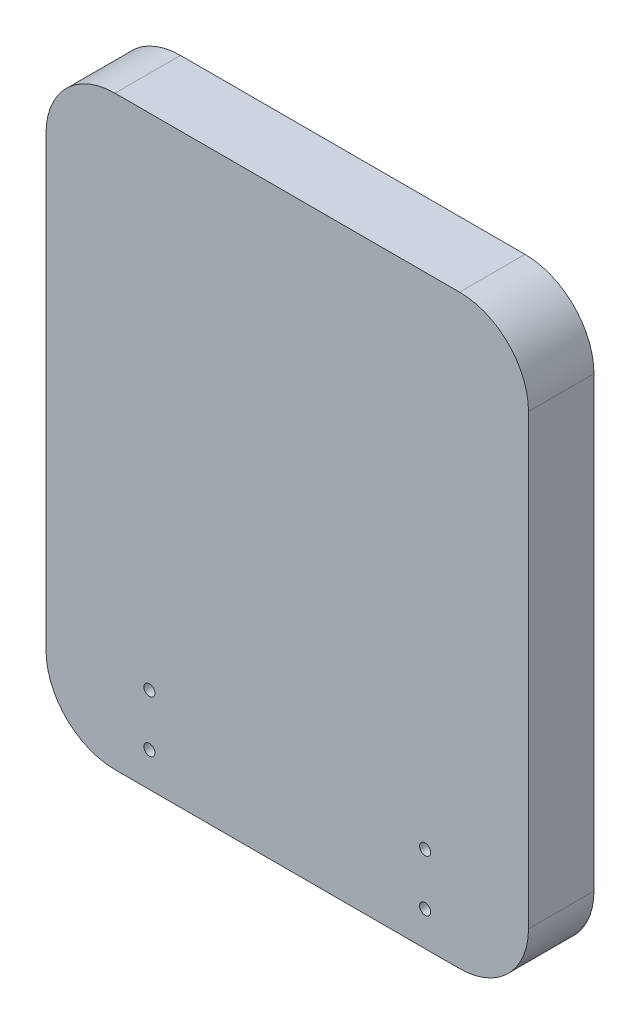
from build123d import *

# Parameters (mm, degrees)
BOSS_EXTRUDE1_DEPTH                      = 5
BOSS_EXTRUDE1_DEPTH_BACK                 = 14
SKETCH1_W                                = 140
SKETCH1_H                                = 170
FILLET1_R                                = 20
SHELL2_T                                 = -4
SHELL2_THICKNESS_2_DEPTH                 = 1
SKETCH2_R                                = 1.8
CUT_EXTRUDE1_DEPTH                       = 4.5
SKETCH3_R                                = 1.8
CUT_EXTRUDE3_DEPTH                       = 4.5
CUT_EXTRUDE4_DEPTH                       = 4
BOSS_EXTRUDE2_DEPTH                      = 14
CUT_EXTRUDE5_DEPTH                       = 4.5
MIRROR1_AT_THE_SECOND_PLANE_COPY_1_DEPTH = 14
MIRROR1_AT_THE_SECOND_PLANE_COPY_2_DEPTH = 4.5
FILLET2_R                                = 3
CHAMFER1_SIZE                            = 0.5
SKETCH7_R                                = 1.6
CUT_EXTRUDE6_DEPTH                       = 126.363678033
SKETCH7_3_R                              = 1.6
CUT_EXTRUDE7_DEPTH                       = 2.5


with BuildPart() as part:
    # Sketch1 → Boss-Extrude1 (new, two sides: drawn at the far end of the back side and taken through both)
    with BuildSketch(Plane.XY.offset(-BOSS_EXTRUDE1_DEPTH_BACK)):
        with Locations((-2.877308189, 16.03934739)):
            Rectangle(SKETCH1_W, SKETCH1_H)
    extrude(amount=BOSS_EXTRUDE1_DEPTH + BOSS_EXTRUDE1_DEPTH_BACK)

    # Fillet1
    fillet1_edges = [part.edges().sort_by_distance(p)[0] for p in [
        (67.122691811, -68.96065261, -4.5),
        (-72.877308189, -68.96065261, -4.5),
        (-72.877308189, 101.03934739, -4.5),
        (67.122691811, 101.03934739, -4.5),
    ]]
    fillet(fillet1_edges, radius=FILLET1_R)

    # Shell2
    shell2_openings = [part.faces().sort_by_distance(p)[0] for p in [
        (-2.877308189, 16.03934739, -14),
    ]]
    offset(amount=SHELL2_T, openings=shell2_openings, kind=Kind.INTERSECTION)

    # Shell2 thickness 2 face (on inner face of the shell) → Shell2 thickness 2 (add)
    with BuildSketch(Plane(origin=(-2.877308189, 16.03934739, 1), x_dir=(1, 0, 0), z_dir=(0, 0, 1))):
        with BuildLine():
            ThreePointArc((-66, 65), (-61.313708499, 76.313708499), (-50, 81))
            Line((-50, 81), (50, 81))
            ThreePointArc((50, 81), (61.313708499, 76.313708499), (66, 65))
            Line((66, 65), (66, -65))
            ThreePointArc((66, -65), (61.313708499, -76.313708499), (50, -81))
            Line((50, -81), (-50, -81))
            ThreePointArc((-50, -81), (-61.313708499, -76.313708499), (-66, -65))
            Line((-66, -65), (-66, 65))
        make_face()
    extrude(amount=-SHELL2_THICKNESS_2_DEPTH)

    # Sketch2 → Cut-Extrude1 (cut)
    with BuildSketch(Plane(origin=(0, 0, 0), x_dir=(-1, 0, 0), z_dir=(0, 0, -1))):
        with Locations((10.377308189, -40.96065261)):
            Circle(SKETCH2_R)
        with Locations((10.377308189, -17.96065261)):
            Circle(SKETCH2_R)
        with Locations((-47.622691811, -17.96065261)):
            Circle(SKETCH2_R)
        with Locations((-47.622691811, -40.96065261)):
            Circle(SKETCH2_R)
    extrude(amount=-CUT_EXTRUDE1_DEPTH, mode=Mode.SUBTRACT)

    # Sketch3 → Cut-Extrude3 (cut)
    with BuildSketch(Plane(origin=(0, 0, 0), x_dir=(-1, 0, 0), z_dir=(0, 0, -1))):
        with Locations((-58.622691811, -5.56065261)):
            Circle(SKETCH3_R)
        with Locations((21.377308189, -5.56065261)):
            Circle(SKETCH3_R)
    extrude(amount=-CUT_EXTRUDE3_DEPTH, mode=Mode.SUBTRACT)

    # Sketch4 → Cut-Extrude4 (cut)
    with BuildSketch(Plane.XZ.offset(68.96065261)):
        with BuildLine():
            ThreePointArc((-6.127308189, -5.08), (-2.877308189, -8.33), (0.372691811, -5.08))
            Line((0.372691811, -5.08), (-6.127308189, -5.08))
        make_face()
        with BuildLine():
            Line((-6.127308189, -5.08), (0.372691811, -5.08))
            ThreePointArc((0.372691811, -5.08), (-2.877308189, -1.83), (-6.127308189, -5.08))
        make_face()
        with BuildLine():
            Line((0.372691811, -14), (0.372691811, -5.08))
            ThreePointArc((0.372691811, -5.08), (-2.877308189, -8.33), (-6.127308189, -5.08))
            Line((-6.127308189, -5.08), (-6.127308189, -14))
            Line((-6.127308189, -14), (0.372691811, -14))
        make_face()
    extrude(amount=-CUT_EXTRUDE4_DEPTH, mode=Mode.SUBTRACT)

    # Sketch6 → Boss-Extrude2 (add)
    with BuildSketch(Plane(origin=(0, 0, -14), x_dir=(-1, 0, 0), z_dir=(0, 0, -1))):
        with BuildLine():
            ThreePointArc((-53.531671708, 85.013896159), (-58.995830787, 86.670706643), (-58.43640031, 92.353055889))
            ThreePointArc((-58.43640031, 92.353055889), (-61.904764331, 87.162282308), (-63.122691811, 81.03934739))
            Line((-63.122691811, 81.03934739), (-53.531671708, 85.013896159))
        make_face()
        with BuildLine():
            ThreePointArc((-50.754419795, 89.171075374), (-53.532344349, 93.32853327), (-58.43640031, 92.353055889))
            Line((-58.43640031, 92.353055889), (-56.810054714, 90.726710293))
            ThreePointArc((-56.810054714, 90.726710293), (-54.412516244, 91.203610346), (-53.054419795, 89.171075374))
            ThreePointArc((-53.054419795, 89.171075374), (-53.221884823, 88.329171823), (-53.698784876, 87.615440455))
            Line((-53.698784876, 87.615440455), (-52.07243928, 85.989094859))
            ThreePointArc((-52.07243928, 85.989094859), (-51.513008803, 86.670706643), (-51.097240579, 87.448327288))
            ThreePointArc((-51.097240579, 87.448327288), (-50.840957069, 88.29281188), (-50.754419795, 89.171075374))
        make_face()
        with BuildLine():
            Line((-56.810054714, 90.726710293), (-58.43640031, 92.353055889))
            ThreePointArc((-58.43640031, 92.353055889), (-58.995830787, 86.670706643), (-53.531671708, 85.013896159))
            ThreePointArc((-53.531671708, 85.013896159), (-52.754051064, 85.429664382), (-52.07243928, 85.989094859))
            Line((-52.07243928, 85.989094859), (-53.698784876, 87.615440455))
            ThreePointArc((-53.698784876, 87.615440455), (-56.810054714, 87.615440455), (-56.810054714, 90.726710293))
        make_face()
        with BuildLine():
            ThreePointArc((-47.122691811, 97.03934739), (-53.245626729, 95.821419911), (-58.43640031, 92.353055889))
            ThreePointArc((-58.43640031, 92.353055889), (-53.532344349, 93.32853327), (-50.754419795, 89.171075374))
            ThreePointArc((-50.754419795, 89.171075374), (-50.840957069, 88.29281188), (-51.097240579, 87.448327288))
            Line((-51.097240579, 87.448327288), (-47.122691811, 97.03934739))
        make_face()
        with BuildLine():
            ThreePointArc((-53.054419795, 89.171075374), (-54.412516244, 91.203610346), (-56.810054714, 90.726710293))
            Line((-56.810054714, 90.726710293), (-53.698784876, 87.615440455))
            ThreePointArc((-53.698784876, 87.615440455), (-53.221884823, 88.329171823), (-53.054419795, 89.171075374))
        make_face()
        with BuildLine():
            Line((-53.698784876, 87.615440455), (-56.810054714, 90.726710293))
            ThreePointArc((-56.810054714, 90.726710293), (-56.810054714, 87.615440455), (-53.698784876, 87.615440455))
        make_face()
    boss_extrude2 = extrude(amount=-BOSS_EXTRUDE2_DEPTH)

    # Sketch6<3> → Cut-Extrude5 (cut)
    with BuildSketch(Plane(origin=(0, 0, -14), x_dir=(-1, 0, 0), z_dir=(0, 0, -1))):
        with BuildLine():
            ThreePointArc((-53.054419795, 89.171075374), (-54.412516244, 91.203610346), (-56.810054714, 90.726710293))
            Line((-56.810054714, 90.726710293), (-53.698784876, 87.615440455))
            ThreePointArc((-53.698784876, 87.615440455), (-53.221884823, 88.329171823), (-53.054419795, 89.171075374))
        make_face()
        with BuildLine():
            Line((-53.698784876, 87.615440455), (-56.810054714, 90.726710293))
            ThreePointArc((-56.810054714, 90.726710293), (-56.810054714, 87.615440455), (-53.698784876, 87.615440455))
        make_face()
    cut_extrude5 = extrude(amount=-CUT_EXTRUDE5_DEPTH, mode=Mode.SUBTRACT)

    # Mirror1: Boss-Extrude2, Cut-Extrude5 across plane
    add(boss_extrude2.mirror(Plane(origin=(0, 16.03934739, 0), x_dir=(0, 0, 1), z_dir=(0, -1, 0))))
    add(cut_extrude5.mirror(Plane(origin=(0, 16.03934739, 0), x_dir=(0, 0, 1), z_dir=(0, -1, 0))), mode=Mode.SUBTRACT)

    # Mirror1 at the second plane: Boss-Extrude2, Cut-Extrude5 across plane
    add(boss_extrude2.mirror(Plane(origin=(-2.877308189, 0, 0), x_dir=(0, 0, 1), z_dir=(1, 0, 0))))
    add(cut_extrude5.mirror(Plane(origin=(-2.877308189, 0, 0), x_dir=(0, 0, 1), z_dir=(1, 0, 0))), mode=Mode.SUBTRACT)

    # Mirror1 at the second plane copy 1 sketc → Mirror1 at the second plane copy 1 (add)
    with BuildSketch(Plane(origin=(-5.754616377, 32.078694781, -14), x_dir=(1, 0, 0), z_dir=(0, 0, -1))):
        with BuildLine():
            ThreePointArc((-53.531671708, 85.013896159), (-58.995830787, 86.670706643), (-58.43640031, 92.353055889))
            ThreePointArc((-58.43640031, 92.353055889), (-61.904764331, 87.162282308), (-63.122691811, 81.03934739))
            Line((-63.122691811, 81.03934739), (-53.531671708, 85.013896159))
        make_face()
        with BuildLine():
            ThreePointArc((-50.754419795, 89.171075374), (-53.532344349, 93.32853327), (-58.43640031, 92.353055889))
            Line((-58.43640031, 92.353055889), (-56.810054714, 90.726710293))
            ThreePointArc((-56.810054714, 90.726710293), (-54.412516244, 91.203610346), (-53.054419795, 89.171075374))
            ThreePointArc((-53.054419795, 89.171075374), (-53.221884823, 88.329171823), (-53.698784876, 87.615440455))
            Line((-53.698784876, 87.615440455), (-52.07243928, 85.989094859))
            ThreePointArc((-52.07243928, 85.989094859), (-51.513008803, 86.670706643), (-51.097240579, 87.448327288))
            ThreePointArc((-51.097240579, 87.448327288), (-50.840957069, 88.29281188), (-50.754419795, 89.171075374))
        make_face()
        with BuildLine():
            Line((-56.810054714, 90.726710293), (-58.43640031, 92.353055889))
            ThreePointArc((-58.43640031, 92.353055889), (-58.995830787, 86.670706643), (-53.531671708, 85.013896159))
            ThreePointArc((-53.531671708, 85.013896159), (-52.754051064, 85.429664382), (-52.07243928, 85.989094859))
            Line((-52.07243928, 85.989094859), (-53.698784876, 87.615440455))
            ThreePointArc((-53.698784876, 87.615440455), (-56.810054714, 87.615440455), (-56.810054714, 90.726710293))
        make_face()
        with BuildLine():
            ThreePointArc((-47.122691811, 97.03934739), (-53.245626729, 95.821419911), (-58.43640031, 92.353055889))
            ThreePointArc((-58.43640031, 92.353055889), (-53.532344349, 93.32853327), (-50.754419795, 89.171075374))
            ThreePointArc((-50.754419795, 89.171075374), (-50.840957069, 88.29281188), (-51.097240579, 87.448327288))
            Line((-51.097240579, 87.448327288), (-47.122691811, 97.03934739))
        make_face()
        with BuildLine():
            ThreePointArc((-53.054419795, 89.171075374), (-54.412516244, 91.203610346), (-56.810054714, 90.726710293))
            Line((-56.810054714, 90.726710293), (-53.698784876, 87.615440455))
            ThreePointArc((-53.698784876, 87.615440455), (-53.221884823, 88.329171823), (-53.054419795, 89.171075374))
        make_face()
        with BuildLine():
            Line((-53.698784876, 87.615440455), (-56.810054714, 90.726710293))
            ThreePointArc((-56.810054714, 90.726710293), (-56.810054714, 87.615440455), (-53.698784876, 87.615440455))
        make_face()
    extrude(amount=-MIRROR1_AT_THE_SECOND_PLANE_COPY_1_DEPTH)

    # Mirror1 at the second plane copy 2 sketc → Mirror1 at the second plane copy 2 (cut)
    with BuildSketch(Plane(origin=(-5.754616377, 32.078694781, -14), x_dir=(1, 0, 0), z_dir=(0, 0, -1))):
        with BuildLine():
            ThreePointArc((-53.054419795, 89.171075374), (-54.412516244, 91.203610346), (-56.810054714, 90.726710293))
            Line((-56.810054714, 90.726710293), (-53.698784876, 87.615440455))
            ThreePointArc((-53.698784876, 87.615440455), (-53.221884823, 88.329171823), (-53.054419795, 89.171075374))
        make_face()
        with BuildLine():
            Line((-53.698784876, 87.615440455), (-56.810054714, 90.726710293))
            ThreePointArc((-56.810054714, 90.726710293), (-56.810054714, 87.615440455), (-53.698784876, 87.615440455))
        make_face()
    extrude(amount=-MIRROR1_AT_THE_SECOND_PLANE_COPY_2_DEPTH, mode=Mode.SUBTRACT)

    # Fillet2
    fillet2_edges = [part.edges().sort_by_distance(p)[0] for p in [
        (63.122691811, 81.03934739, -7),
        (63.122691811, -48.96065261, -7),
        (-68.877308189, 81.03934739, -7),
        (-68.877308189, -48.96065261, -7),
        (-52.877308189, 97.03934739, -7),
        (47.122691811, 97.03934739, -7),
    ]]
    fillet(fillet2_edges, radius=FILLET2_R)

    # Chamfer1
    chamfer1_edges = [part.edges().sort_by_distance(p)[0] for p in [
        (53.698784876, 87.615440455, -14),
        (-59.453401254, 87.615440455, -14),
        (53.698784876, -55.536745675, -14),
        (-59.453401254, -55.536745675, -14),
        (49.422691811, -40.96065261, 0),
        (49.422691811, -17.96065261, 0),
        (-8.577308189, -17.96065261, 0),
        (-8.577308189, -40.96065261, 0),
        (60.422691811, -5.56065261, 0),
        (-19.577308189, -5.56065261, 0),
    ]]
    chamfer(chamfer1_edges, length=CHAMFER1_SIZE)

    # Sketch7 → Cut-Extrude6 (cut, through all)
    with BuildSketch(Plane(origin=(0, 0, 0), x_dir=(-1, 0, 0), z_dir=(0, 0, -1))):
        with Locations((-37.122691811, -58.96065261)):
            Circle(SKETCH7_R)
        with Locations((-37.122691811, -43.96065261)):
            Circle(SKETCH7_R)
    cut_extrude6 = extrude(amount=-CUT_EXTRUDE6_DEPTH, mode=Mode.SUBTRACT)

    # Sketch7<3> → Cut-Extrude7 (cut)
    # profile 1 of 2: a face of its own
    with BuildSketch(Plane(origin=(0, 0, 0), x_dir=(-1, 0, 0), z_dir=(0, 0, -1))):
        Polygon((-37.122691811, -47.424754225), (-34.122691811, -45.692703417), (-34.122691811, -42.228601802), (-37.122691811, -40.496550994), (-40.122691811, -42.228601802), (-40.122691811, -45.692703417), align=None)
        with Locations((-37.122691811, -43.96065261)):
            Circle(SKETCH7_3_R, mode=Mode.SUBTRACT)
    # profile 2 of 2: a face of its own
    with BuildSketch(Plane(origin=(0, 0, 0), x_dir=(-1, 0, 0), z_dir=(0, 0, -1))):
        Polygon((-37.117210505, -55.496555331), (-40.119947403, -57.22385702), (-40.125428709, -60.687954299), (-37.128173117, -62.424749888), (-34.12543622, -60.697448199), (-34.119954914, -57.233350921), align=None)
        with Locations((-37.122691811, -58.96065261)):
            Circle(SKETCH7_3_R, mode=Mode.SUBTRACT)
    cut_extrude7 = extrude(amount=-CUT_EXTRUDE7_DEPTH, mode=Mode.SUBTRACT)

    # Mirror2: Cut-Extrude6, Cut-Extrude7 across plane
    add(cut_extrude6.mirror(Plane(origin=(-2.877308189, 0, 0), x_dir=(0, 0, 1), z_dir=(1, 0, 0))), mode=Mode.SUBTRACT)
    add(cut_extrude7.mirror(Plane(origin=(-2.877308189, 0, 0), x_dir=(0, 0, 1), z_dir=(1, 0, 0))), mode=Mode.SUBTRACT)


solid = part.part
